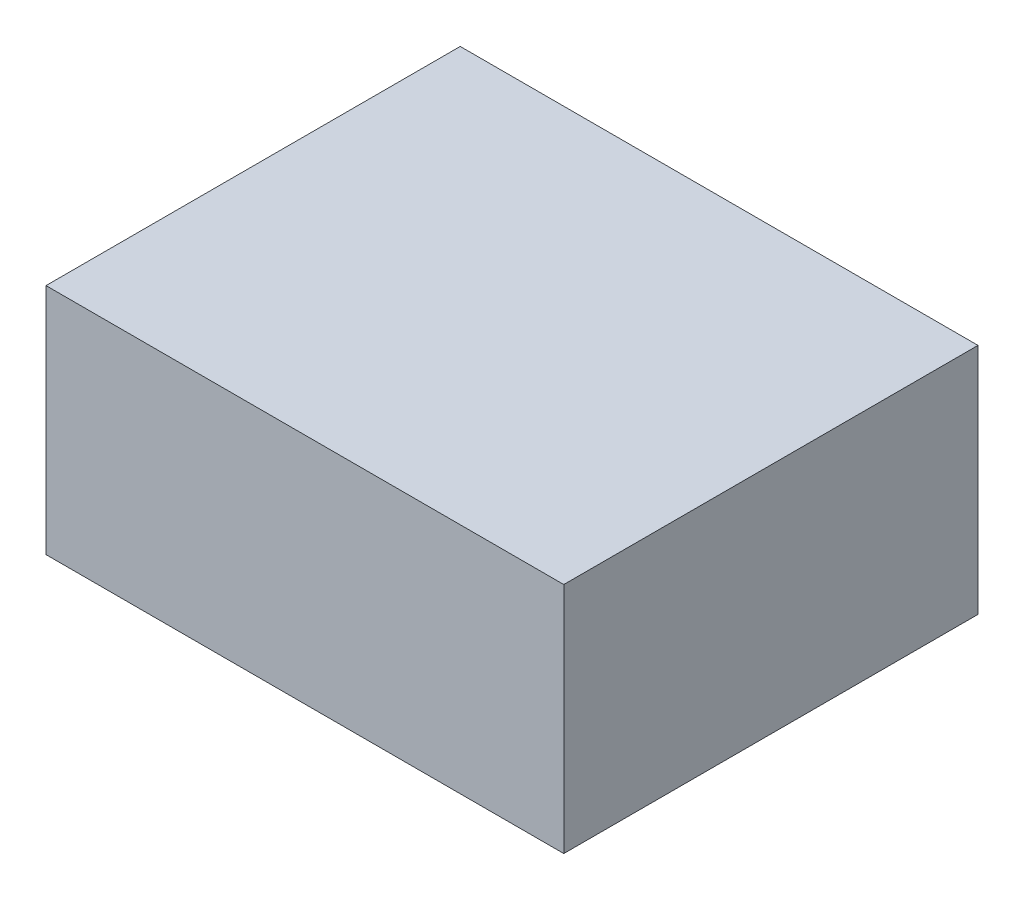
from build123d import *

# Parameters (mm, degrees)
SKETCH_1_W      = 100
SKETCH_1_H      = 80
EXTRUDE_1_DEPTH = 45


with BuildPart() as part:
    # 草图1 → 凸台-拉伸1 (new body)
    with BuildSketch(Plane(origin=(0, 0, 0), x_dir=(1, 0, 0), z_dir=(0, 1, 0))):
        with Locations((50, -40)):
            Rectangle(SKETCH_1_W, SKETCH_1_H)
    extrude(amount=EXTRUDE_1_DEPTH)


solid = part.part
